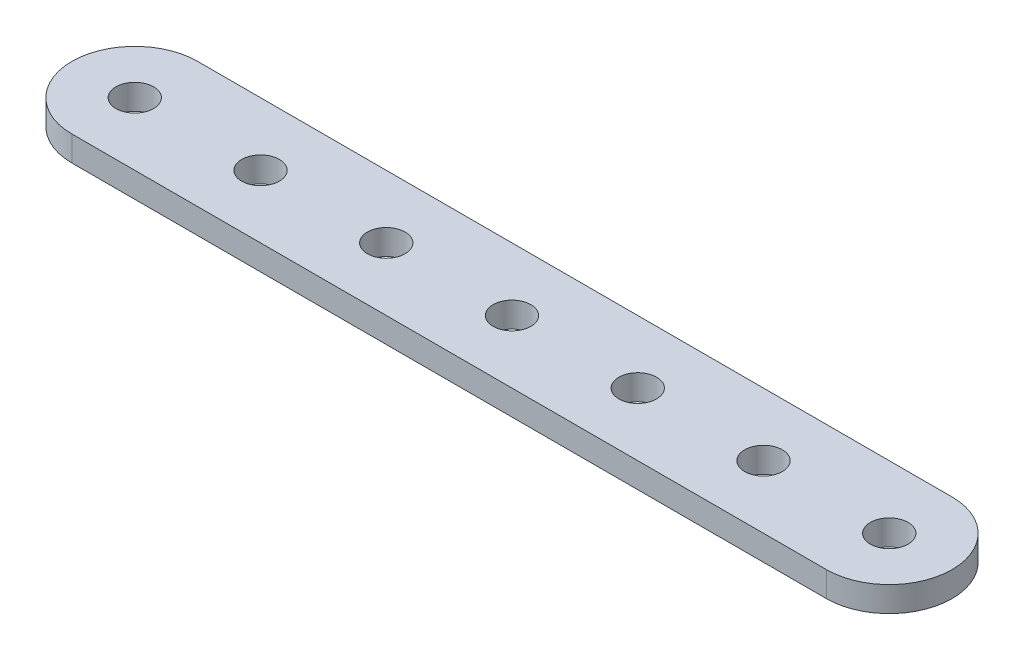
from build123d import *

# Parameters (mm, degrees)
SKETCH1_R           = 7.5
BOSS_EXTRUDE1_DEPTH = 10


with BuildPart() as part:
    # Sketch1 → Boss-Extrude1 (new body)
    with BuildSketch(Plane(origin=(0, 0, 0), x_dir=(1, 0, 0), z_dir=(0, 1, 0))):
        with BuildLine():
            Line((-150, 25), (150, 25))
            ThreePointArc((150, 25), (175, 0), (150, -25))
            Line((150, -25), (-150, -25))
            ThreePointArc((-150, -25), (-175, 0), (-150, 25))
        make_face()
        with Locations(Location((-150, 0, 0), (0, 0, 270))):
            Circle(SKETCH1_R, mode=Mode.SUBTRACT)
        with Locations(Location((150, 0, 0), (0, 0, 270))):
            Circle(SKETCH1_R, mode=Mode.SUBTRACT)
        with Locations(Location((-100, 0, 0), (0, 0, 270))):
            Circle(SKETCH1_R, mode=Mode.SUBTRACT)
        with Locations(Location((-50, 0, 0), (0, 0, 270))):
            Circle(SKETCH1_R, mode=Mode.SUBTRACT)
        with Locations(Location((0, 0, 0), (0, 0, 270))):
            Circle(SKETCH1_R, mode=Mode.SUBTRACT)
        with Locations(Location((50, 0, 0), (0, 0, 270))):
            Circle(SKETCH1_R, mode=Mode.SUBTRACT)
        with Locations(Location((100, 0, 0), (0, 0, 270))):
            Circle(SKETCH1_R, mode=Mode.SUBTRACT)
    extrude(amount=BOSS_EXTRUDE1_DEPTH)


solid = part.part
